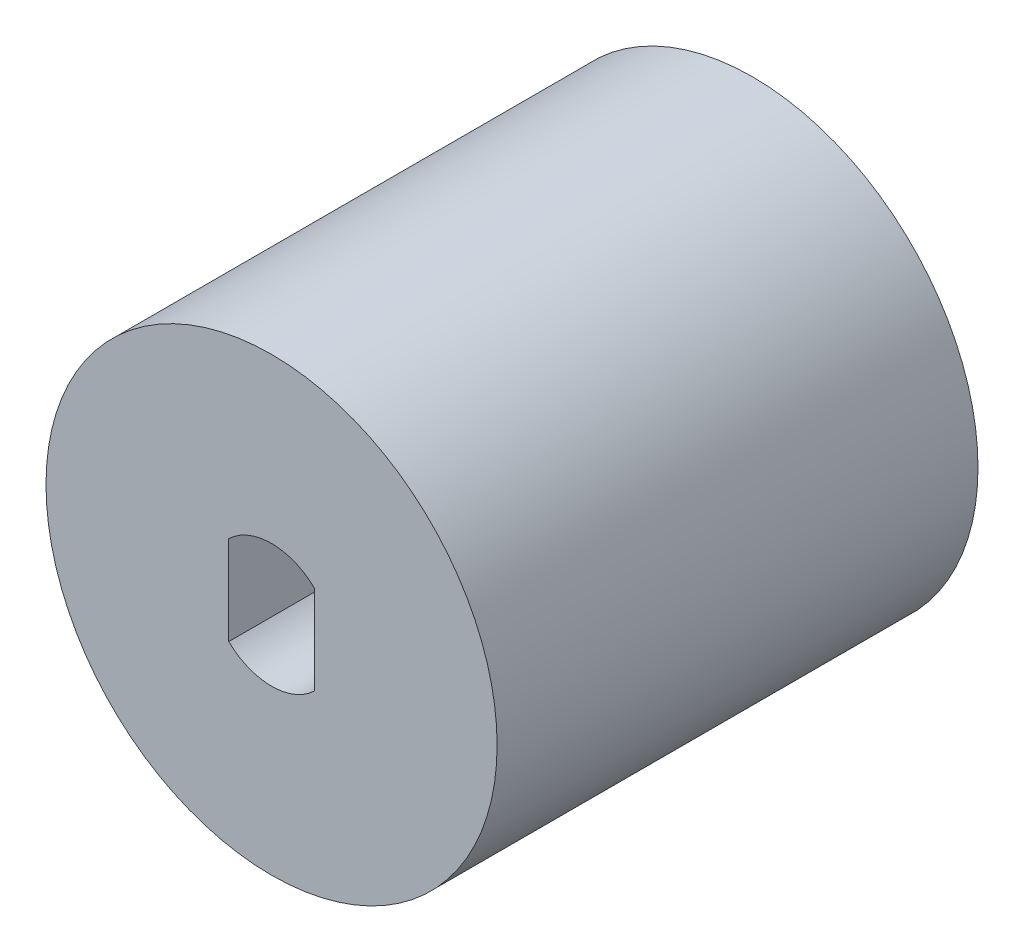
from build123d import *

# Parameters (mm, degrees)
CROQUIS1_R              = 9.85
SALIENTE_EXTRUIR2_DEPTH = 21
CORTAR_EXTRUIR1_DEPTH   = 21


with BuildPart() as part:
    # Croquis1 → Saliente-Extruir2 (new body)
    with BuildSketch(Plane.XY):
        with Locations(Location((0, 0, 0), (0, 0, 180))):
            Circle(CROQUIS1_R)
    extrude(amount=SALIENTE_EXTRUIR2_DEPTH)

    # Croquis2 → Cortar-Extruir1 (cut)
    with BuildSketch(Plane.XY):
        with BuildLine():
            Line((-1.87, 1.947588252), (-1.87, -1.947588252))
            ThreePointArc((-1.87, -1.947588252), (0, -2.7), (1.87, -1.947588252))
            Line((1.87, -1.947588252), (1.87, 1.947588252))
            ThreePointArc((1.87, 1.947588252), (0, 2.7), (-1.87, 1.947588252))
        make_face()
    extrude(amount=CORTAR_EXTRUIR1_DEPTH, mode=Mode.SUBTRACT)


solid = part.part
